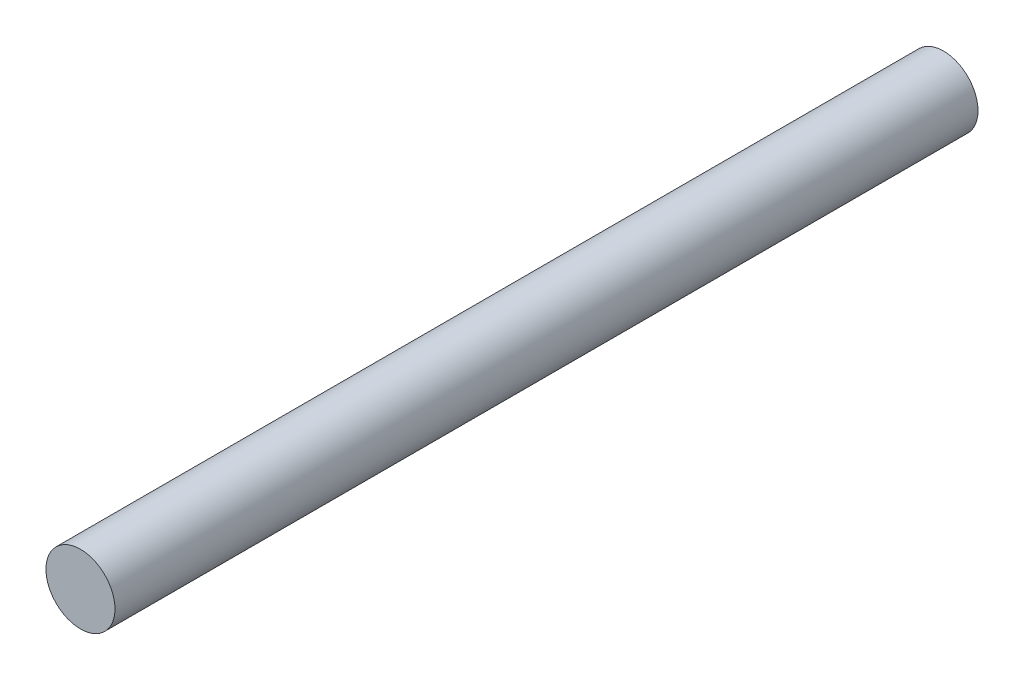
from build123d import *

# Parameters (mm, degrees)
SKETCH1_R           = 3
BOSS_EXTRUDE1_DEPTH = 75


with BuildPart() as part:
    # Sketch1 → Boss-Extrude1 (new body)
    with BuildSketch(Plane.XY):
        Circle(SKETCH1_R)
    extrude(amount=BOSS_EXTRUDE1_DEPTH)


solid = part.part
